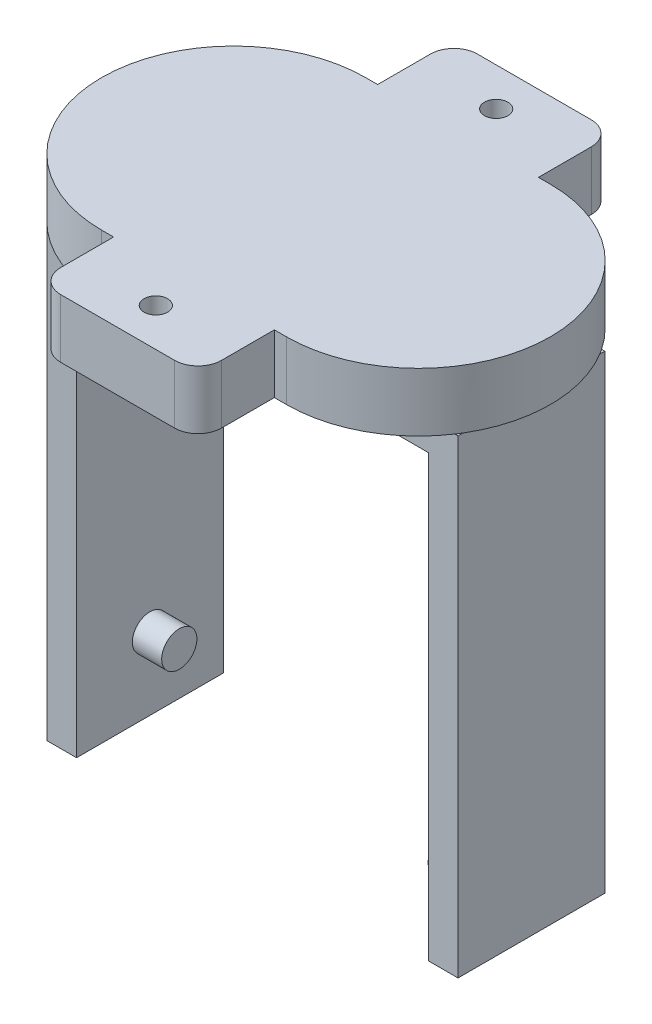
from build123d import *

# Parameters (mm, degrees)
SKETCH_1_W       = 25
SKETCH_1_H       = 80
EXTRUDE_1_DEPTH  = 5
SKETCH_8_W       = 25
SKETCH_8_H       = 5
EXTRUDE_6_DEPTH  = 60
SKETCH_9_W       = 25
SKETCH_9_H       = 80
EXTRUDE_7_DEPTH  = 5
SKETCH_10_R      = 10.3
EXTRUDE_9_DEPTH  = 2.3
SKETCH_12_R      = 4.35
SKETCH_12_R_2    = 3
EXTRUDE_10_DEPTH = 3.15
EXTRUDE_START    = 5
SKETCH_13_R      = 3
EXTRUDE_11_DEPTH = 5
SKETCH_15_R      = 2
EXTRUDE_12_DEPTH = 10


with BuildPart() as part:
    # 草圖1 → 填料-伸長1 (new body)
    with BuildSketch(Plane(origin=(0, 0, 0), x_dir=(0, 0, -1), z_dir=(1, 0, 0))):
        with Locations((0.068306011, -18.756830601)):
            Rectangle(SKETCH_1_W, SKETCH_1_H)
    extrude(amount=EXTRUDE_1_DEPTH)

    # 草圖8 → 填料-伸長6 (add)
    with BuildSketch(Plane(origin=(5, 0, 0), x_dir=(0, 0, -1), z_dir=(1, 0, 0))):
        with Locations((0.068306011, 18.743169399)):
            Rectangle(SKETCH_8_W, SKETCH_8_H)
    extrude(amount=EXTRUDE_6_DEPTH)

    # 草圖9 → 填料-伸長7 (add)
    with BuildSketch(Plane(origin=(65, 0, 0), x_dir=(0, 0, -1), z_dir=(1, 0, 0))):
        with Locations((0.068306011, -18.756830601)):
            Rectangle(SKETCH_9_W, SKETCH_9_H)
    extrude(amount=EXTRUDE_7_DEPTH)

    # 草圖10 → 填料-伸長9 (add)
    with BuildSketch(Plane.ZY.offset(-65)):
        with Locations(Location((-0.068306011, -46.456830601, 0), (0, 0, 180))):
            Circle(SKETCH_10_R)
    extrude(amount=EXTRUDE_9_DEPTH)

    # 草圖12 → 填料-伸長10 (add)
    with BuildSketch(Plane.ZY.offset(-62.7)):
        with Locations((-0.068306011, -46.456830601)):
            Circle(SKETCH_12_R)
        with Locations((-0.068306011, -46.456830601)):
            Circle(SKETCH_12_R_2, mode=Mode.SUBTRACT)
    extrude(amount=EXTRUDE_10_DEPTH)

    # 草圖13 → 填料-伸長11 (add)
    with BuildSketch(Plane(origin=(5, 0, 0), x_dir=(0, 0, -1), z_dir=(1, 0, 0)).offset(EXTRUDE_START)):
        with Locations(Location((0.068306011, -46.456830601, 0), (0, 0, 180))):
            Circle(SKETCH_13_R)
    extrude(amount=-EXTRUDE_11_DEPTH)

    # 草圖15 → 填料-伸長12 (add)
    # profile 1 of 3: a face of its own
    with BuildSketch(Plane(origin=(0, 21.243169399, 0), x_dir=(1, 0, 0), z_dir=(0, 1, 0))):
        with BuildLine():
            Line((19.25, 22.568306011), (50.75, 22.568306011))
            ThreePointArc((50.75, 22.568306011), (73.25, 0.068306011), (50.75, -22.431693989))
            Line((50.75, -22.431693989), (19.25, -22.431693989))
            ThreePointArc((19.25, -22.431693989), (-3.25, 0.068306011), (19.25, 22.568306011))
        make_face()
    # profile 2 of 3: a face of its own
    with BuildSketch(Plane(origin=(0, 21.243169399, 0), x_dir=(1, 0, 0), z_dir=(0, 1, 0))):
        with BuildLine():
            Line((48.7, -22.431693989), (21.3, -22.431693989))
            Line((21.3, -22.431693989), (21.3, -31.431693989))
            ThreePointArc((21.3, -31.431693989), (22.471572875, -34.260121114), (25.3, -35.431693989))
            Line((25.3, -35.431693989), (44.7, -35.431693989))
            ThreePointArc((44.7, -35.431693989), (47.528427125, -34.260121114), (48.7, -31.431693989))
            Line((48.7, -31.431693989), (48.7, -22.431693989))
        make_face()
        with Locations(Location((35, -28.931693989, 0), (0, 0, 270))):
            Circle(SKETCH_15_R, mode=Mode.SUBTRACT)
    # profile 3 of 3: a face of its own
    with BuildSketch(Plane(origin=(0, 21.243169399, 0), x_dir=(1, 0, 0), z_dir=(0, 1, 0))):
        with BuildLine():
            Line((21.3, 22.568306011), (48.7, 22.568306011))
            Line((48.7, 22.568306011), (48.7, 31.568306011))
            ThreePointArc((48.7, 31.568306011), (47.528427125, 34.396733136), (44.7, 35.568306011))
            Line((44.7, 35.568306011), (25.3, 35.568306011))
            ThreePointArc((25.3, 35.568306011), (22.471572875, 34.396733136), (21.3, 31.568306011))
            Line((21.3, 31.568306011), (21.3, 22.568306011))
        make_face()
        with Locations(Location((35, 29.068306011, 0), (0, 0, 270))):
            Circle(SKETCH_15_R, mode=Mode.SUBTRACT)
    extrude(amount=EXTRUDE_12_DEPTH)


solid = part.part
